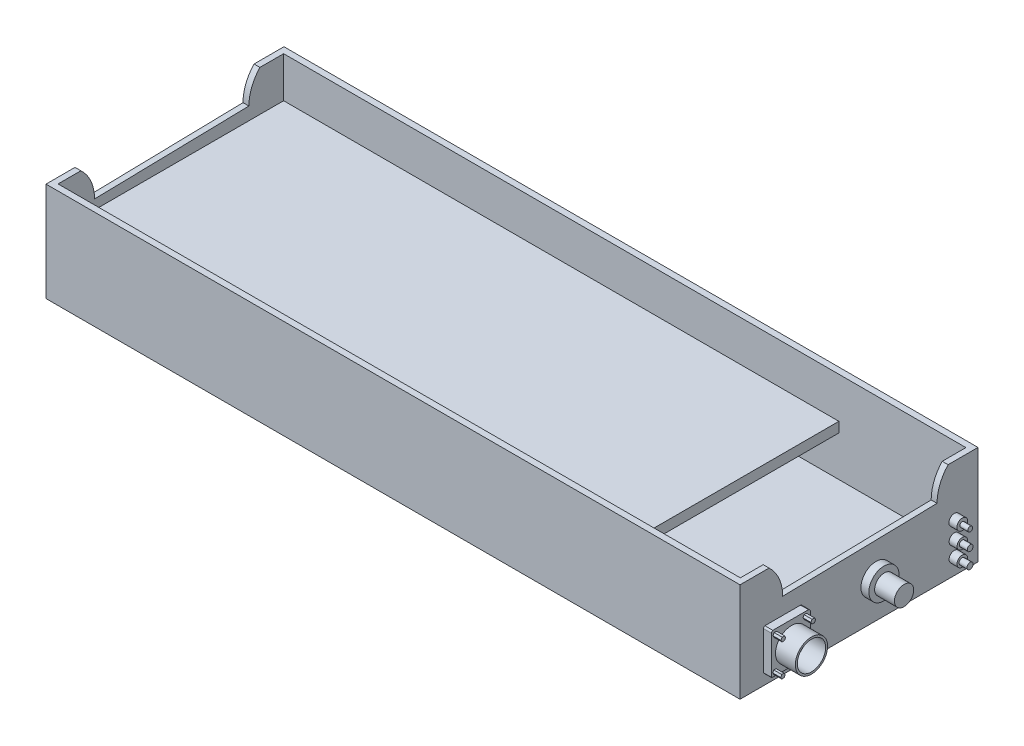
from build123d import *

# Parameters (mm, degrees)
SKETCH1_W            = 175
SKETCH1_H            = 60
BOSS_EXTRUDE1_DEPTH  = 25
SKETCH2_W            = 172.037419054
SKETCH2_H            = 56.878309912
CUT_EXTRUDE2_DEPTH   = 23
CUT_EXTRUDE4_DEPTH   = 180.30421077
SKETCH5_W            = 56.619672169
SKETCH5_H            = 2.543260903
BOSS_EXTRUDE2_DEPTH  = 140
BOSS_EXTRUDE3_DEPTH  = 2
SKETCH7_R            = 4.069899946
SKETCH7_R_2          = 3.573578561
BOSS_EXTRUDE4_DEPTH  = 5
BOSS_EXTRUDE6_DEPTH  = 2
SKETCH9_R            = 3.803746222
BOSS_EXTRUDE7_DEPTH  = 2
SKETCH10_R           = 2.430826278
BOSS_EXTRUDE8_DEPTH  = 5
SKETCH11_R           = 1.370011297
SKETCH11_R_2         = 1.313817757
SKETCH11_R_3         = 1.331167219
BOSS_EXTRUDE9_DEPTH  = 2
SKETCH12_R           = 0.613636394
SKETCH12_R_2         = 0.736542168
SKETCH12_R_3         = 0.775004172
BOSS_EXTRUDE10_DEPTH = 2


with BuildPart() as part:
    # Sketch1 → Boss-Extrude1 (new body)
    with BuildSketch(Plane(origin=(0, 0, 0), x_dir=(1, 0, 0), z_dir=(0, 1, 0))):
        Rectangle(SKETCH1_W, SKETCH1_H)
    extrude(amount=BOSS_EXTRUDE1_DEPTH)

    # Sketch2 → Cut-Extrude2 (cut)
    with BuildSketch(Plane(origin=(0, 25, 0), x_dir=(1, 0, 0), z_dir=(0, 1, 0))):
        Rectangle(SKETCH2_W, SKETCH2_H)
    extrude(amount=-CUT_EXTRUDE2_DEPTH, mode=Mode.SUBTRACT)

    # Sketch3 → Cut-Extrude4 (cut, through all)
    with BuildSketch(Plane(origin=(87.5, 0, 0), x_dir=(0, 0, -1), z_dir=(1, 0, 0))):
        with BuildLine():
            ThreePointArc((-22.681609782, 25), (-20.139304377, 21.416181436), (-19.241971202, 17.114801954))
            Line((-19.241971202, 17.114801954), (19.672994279, 17.951296347))
            ThreePointArc((19.672994279, 17.951296347), (20.393002527, 21.739785058), (22.452628009, 25))
            Line((22.452628009, 25), (-22.681609782, 25))
        make_face()
    extrude(amount=-CUT_EXTRUDE4_DEPTH, mode=Mode.SUBTRACT)

    # Sketch5 → Boss-Extrude2 (add)
    with BuildSketch(Plane(origin=(-86.018709527, 0, 0), x_dir=(0, 0, -1), z_dir=(1, 0, 0))):
        with Locations((0.129318872, 13.450991009)):
            Rectangle(SKETCH5_W, SKETCH5_H)
    extrude(amount=BOSS_EXTRUDE2_DEPTH)

    # Sketch6 → Boss-Extrude3 (add)
    with BuildSketch(Plane(origin=(87.5, 0, 0), x_dir=(0, 0, -1), z_dir=(1, 0, 0))):
        with BuildLine():
            Line((-23.739887735, 12.934037749), (-14.749940356, 12.934037749))
            ThreePointArc((-14.749940356, 12.934037749), (-14.474436425, 12.796150035), (-14.296501276, 12.544645521))
            Line((-14.296501276, 12.544645521), (-14.296501276, 2.814596709))
            ThreePointArc((-14.296501276, 2.814596709), (-14.348088202, 2.742066754), (-14.427356599, 2.701590504))
            Line((-14.427356599, 2.701590504), (-23.96895697, 2.701590504))
            ThreePointArc((-23.96895697, 2.701590504), (-24.058326953, 2.766456684), (-24.077974584, 2.875124001))
            Line((-24.077974584, 2.875124001), (-24.077974584, 12.450209245))
            ThreePointArc((-24.077974584, 12.450209245), (-24.000062189, 12.755803504), (-23.739887735, 12.934037749))
        make_face()
    extrude(amount=BOSS_EXTRUDE3_DEPTH)

    # Sketch7 → Boss-Extrude4 (add)
    with BuildSketch(Plane(origin=(89.5, 0, 0), x_dir=(0, 0, -1), z_dir=(1, 0, 0))):
        with Locations((-18.991835841, 7.548541402)):
            Circle(SKETCH7_R)
        with Locations((-18.991835841, 7.548541402)):
            Circle(SKETCH7_R_2, mode=Mode.SUBTRACT)
    extrude(amount=BOSS_EXTRUDE4_DEPTH)

    # Sketch8 → Boss-Extrude6 (add)
    with BuildSketch(Plane(origin=(89.5, 0, 0), x_dir=(0, 0, -1), z_dir=(1, 0, 0))):
        Polygon((-22.791586736, 11.211896935), (-22.48659006, 11.74204685), (-22.793215015, 12.271256677), (-23.404836647, 12.27031659), (-23.709833324, 11.740166675), (-23.403208368, 11.210956848), align=None)
        Polygon((-15.214334729, 11.35367817), (-14.921128157, 11.882675416), (-15.232649924, 12.40109838), (-15.837378264, 12.390524097), (-16.130584836, 11.861526851), (-15.819063069, 11.343103888), align=None)
        Polygon((-22.614375311, 3.648960977), (-22.903289414, 4.149374881), (-23.481117618, 4.149374881), (-23.770031721, 3.648960977), (-23.481117618, 3.148547073), (-22.903289414, 3.148547073), align=None)
        Polygon((-14.98393783, 3.084271685), (-14.687192917, 3.521636864), (-14.917589816, 3.997308087), (-15.444731629, 4.035614131), (-15.741476542, 3.598248952), (-15.511079643, 3.122577729), align=None)
    extrude(amount=BOSS_EXTRUDE6_DEPTH)

    # Sketch9 → Boss-Extrude7 (add)
    with BuildSketch(Plane(origin=(87.5, 0, 0), x_dir=(0, 0, -1), z_dir=(1, 0, 0))):
        with Locations(Location((4.287117765, 9.151764618, 0), (0, 0, 180))):
            Circle(SKETCH9_R)
    extrude(amount=BOSS_EXTRUDE7_DEPTH)

    # Sketch10 → Boss-Extrude8 (add)
    with BuildSketch(Plane(origin=(89.5, 0, 0), x_dir=(0, 0, -1), z_dir=(1, 0, 0))):
        with Locations((4.363010591, 8.979818711)):
            Circle(SKETCH10_R)
    extrude(amount=BOSS_EXTRUDE8_DEPTH)

    # Sketch11 → Boss-Extrude9 (add)
    with BuildSketch(Plane(origin=(87.5, 0, 0), x_dir=(0, 0, -1), z_dir=(1, 0, 0))):
        with Locations(Location((24.040397356, 12.193405529, 0), (0, 0, 180))):
            Circle(SKETCH11_R)
        with Locations(Location((24.040397356, 8.016708701, 0), (0, 0, 180))):
            Circle(SKETCH11_R_2)
        with Locations(Location((24.040397356, 4.159285121, 0), (0, 0, 180))):
            Circle(SKETCH11_R_3)
    extrude(amount=BOSS_EXTRUDE9_DEPTH)

    # Sketch12 → Boss-Extrude10 (add)
    with BuildSketch(Plane(origin=(89.5, 0, 0), x_dir=(0, 0, -1), z_dir=(1, 0, 0))):
        with Locations((24.040397356, 12.144680604)):
            Circle(SKETCH12_R)
        with Locations((24.040397356, 8.016708701)):
            Circle(SKETCH12_R_2)
        with Locations((23.993599031, 4.133922204)):
            Circle(SKETCH12_R_3)
    extrude(amount=BOSS_EXTRUDE10_DEPTH)


solid = part.part
